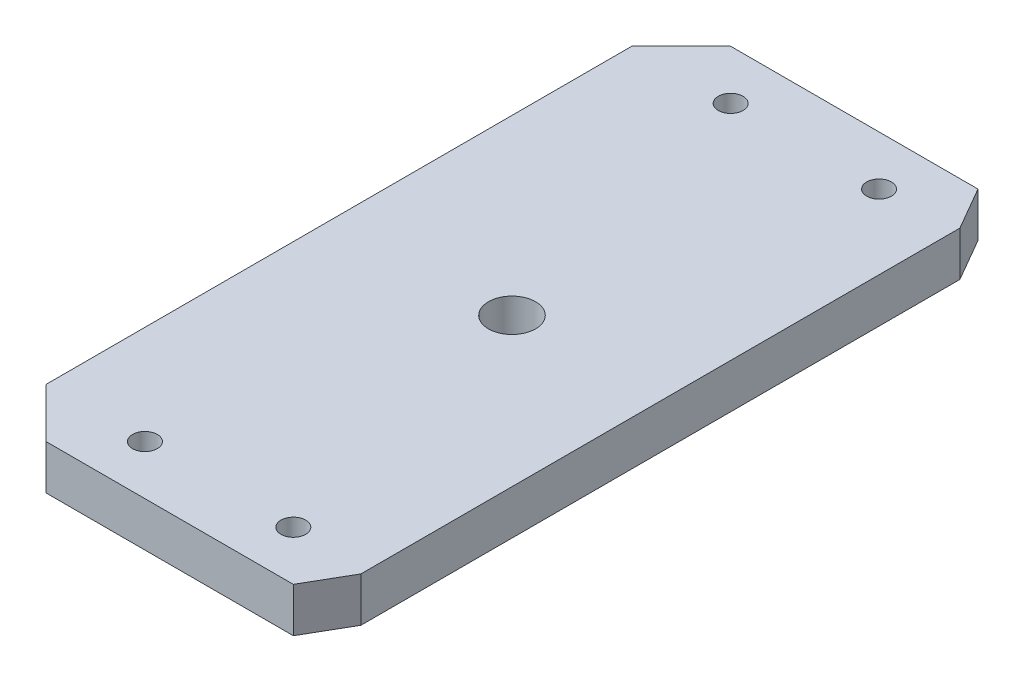
from build123d import *

# Parameters (mm, degrees)
CROQUIS1_W              = 50
CROQUIS1_H              = 138.4
CROQUIS1_R              = 4.7625
SALIENTE_EXTRUIR1_DEPTH = 9
CROQUIS2_R              = 2.5
CORTAR_EXTRUIR1_DEPTH   = 75.12583895
SALIENTE_EXTRUIR2_DEPTH = 9


with BuildPart() as part:
    # Croquis1 → Saliente-Extruir1 (new body)
    with BuildSketch(Plane(origin=(0, 0, 0), x_dir=(1, 0, 0), z_dir=(0, 1, 0))):
        Rectangle(CROQUIS1_W, CROQUIS1_H)
        with Locations(Location((0, 0, 0), (0, 0, 270))):
            Circle(CROQUIS1_R, mode=Mode.SUBTRACT)
    extrude(amount=SALIENTE_EXTRUIR1_DEPTH)

    # Croquis2 → Cortar-Extruir1 (cut, through all)
    with BuildSketch(Plane(origin=(0, 9, 0), x_dir=(1, 0, 0), z_dir=(0, 1, 0))):
        with Locations(Location((-15, -59.2, 0), (0, 0, 270))):
            Circle(CROQUIS2_R)
        with Locations(Location((15, -59.2, 0), (0, 0, 90))):
            Circle(CROQUIS2_R)
        with Locations(Location((15, 59.2, 0), (0, 0, 270))):
            Circle(CROQUIS2_R)
        with Locations(Location((-15, 59.2, 0), (0, 0, 90))):
            Circle(CROQUIS2_R)
    extrude(amount=-CORTAR_EXTRUIR1_DEPTH, mode=Mode.SUBTRACT)

    # Croquis3 → Saliente-Extruir2 (add)
    with BuildSketch(Plane(origin=(0, 9, 0), x_dir=(1, 0, 0), z_dir=(0, 1, 0))):
        Polygon((-25, 69.2), (-25, -69.2), (-35, -59.2), (-35, 59.2), align=None)
        Polygon((25, 69.2), (25, -69.2), (30, -60.539745962), (30, 60.539745962), align=None)
    extrude(amount=-SALIENTE_EXTRUIR2_DEPTH)


solid = part.part
